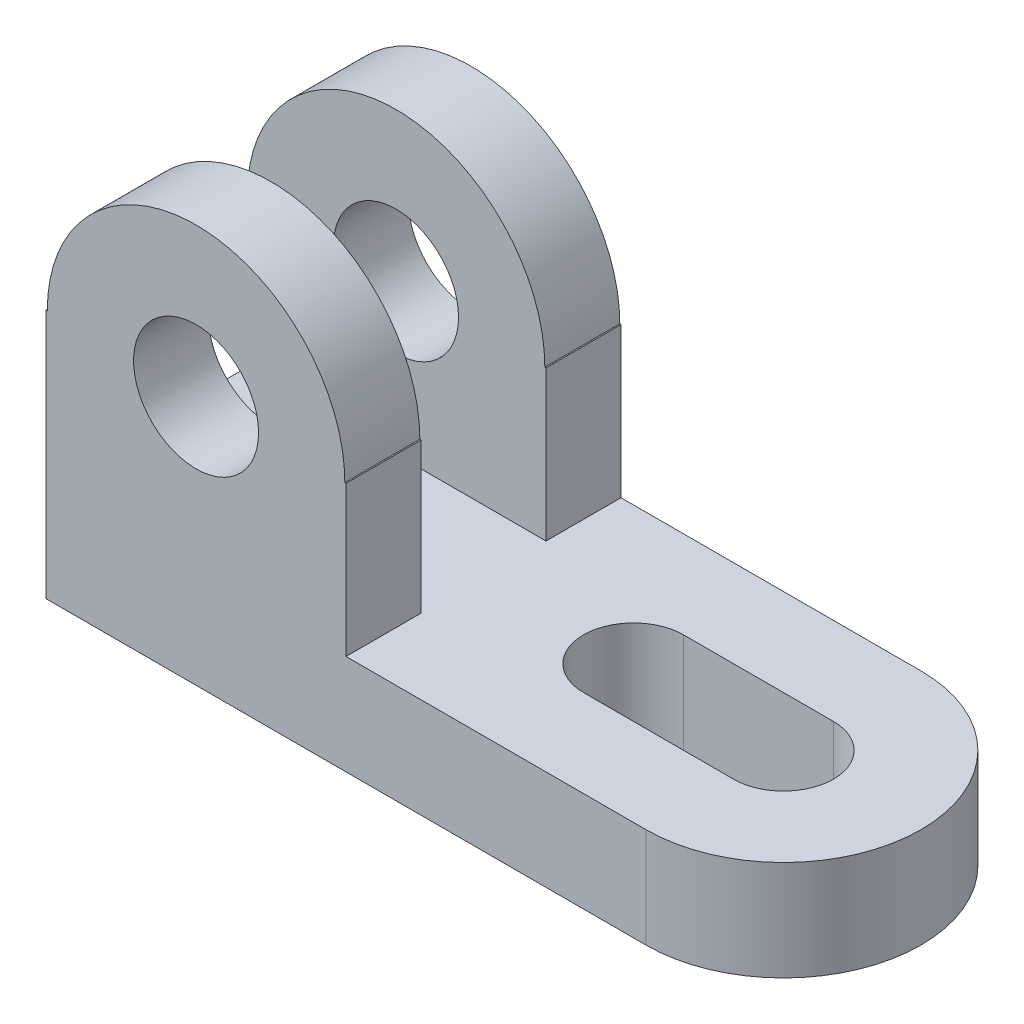
from build123d import *

# Parameters (mm, degrees)
SKETCH1_R           = 22
BOSS_EXTRUDE1_DEPTH = 16
CUT_EXTRUDE1_DEPTH  = 16
BOSS_EXTRUDE2_DEPTH = 12


with BuildPart() as part:
    # Sketch1 → Boss-Extrude1 (new body)
    with BuildSketch(Plane(origin=(0, 0, 0), x_dir=(1, 0, 0), z_dir=(0, 1, 0))):
        with BuildLine():
            Line((37.000000064, 22), (-59, 22))
            Line((-59, 22), (-59, -22))
            Line((-59, -22), (37, -22))
            ThreePointArc((37, -22), (15, 3.2e-08), (37.000000064, 22))
        make_face()
        with Locations((37, 0)):
            Circle(SKETCH1_R)
    extrude(amount=BOSS_EXTRUDE1_DEPTH)

    # Sketch2 → Cut-Extrude1 (cut)
    with BuildSketch(Plane(origin=(0, 16, 0), x_dir=(1, 0, 0), z_dir=(0, 1, 0))):
        with BuildLine():
            Line((37, -8), (13, -8))
            ThreePointArc((13, -8), (5, 0), (13, 8))
            Line((13, 8), (37, 8))
            ThreePointArc((37, 8), (45, 0), (37, -8))
        make_face()
    extrude(amount=-CUT_EXTRUDE1_DEPTH, mode=Mode.SUBTRACT)

    # Sketch3 → Boss-Extrude2 (add)
    with BuildSketch(Plane.XY.offset(22)):
        with BuildLine():
            ThreePointArc((-11.192127745, 40), (-35, 63.807872255), (-58.807872255, 40))
            Line((-58.807872255, 40), (-45, 40))
            ThreePointArc((-45, 40), (-35, 50), (-25, 40))
            Line((-25, 40), (-11.192127745, 40))
        make_face()
        with BuildLine():
            Line((-45, 40), (-58.807872255, 40))
            ThreePointArc((-58.807872255, 40), (-35, 16.192127745), (-11.192127745, 40))
            Line((-11.192127745, 40), (-25, 40))
            ThreePointArc((-25, 40), (-35, 30), (-45, 40))
        make_face()
        with BuildLine():
            Line((-59, 40), (-59, 16))
            Line((-59, 16), (-11, 16))
            Line((-11, 16), (-11, 40))
            Line((-11, 40), (-11.192127745, 40))
            ThreePointArc((-11.192127745, 40), (-35, 16.192127745), (-58.807872255, 40))
            Line((-58.807872255, 40), (-59, 40))
        make_face()
    boss_extrude2 = extrude(amount=-BOSS_EXTRUDE2_DEPTH)

    # Mirror1: Boss-Extrude2 across plane
    add(boss_extrude2.mirror(Plane.XY))


solid = part.part
